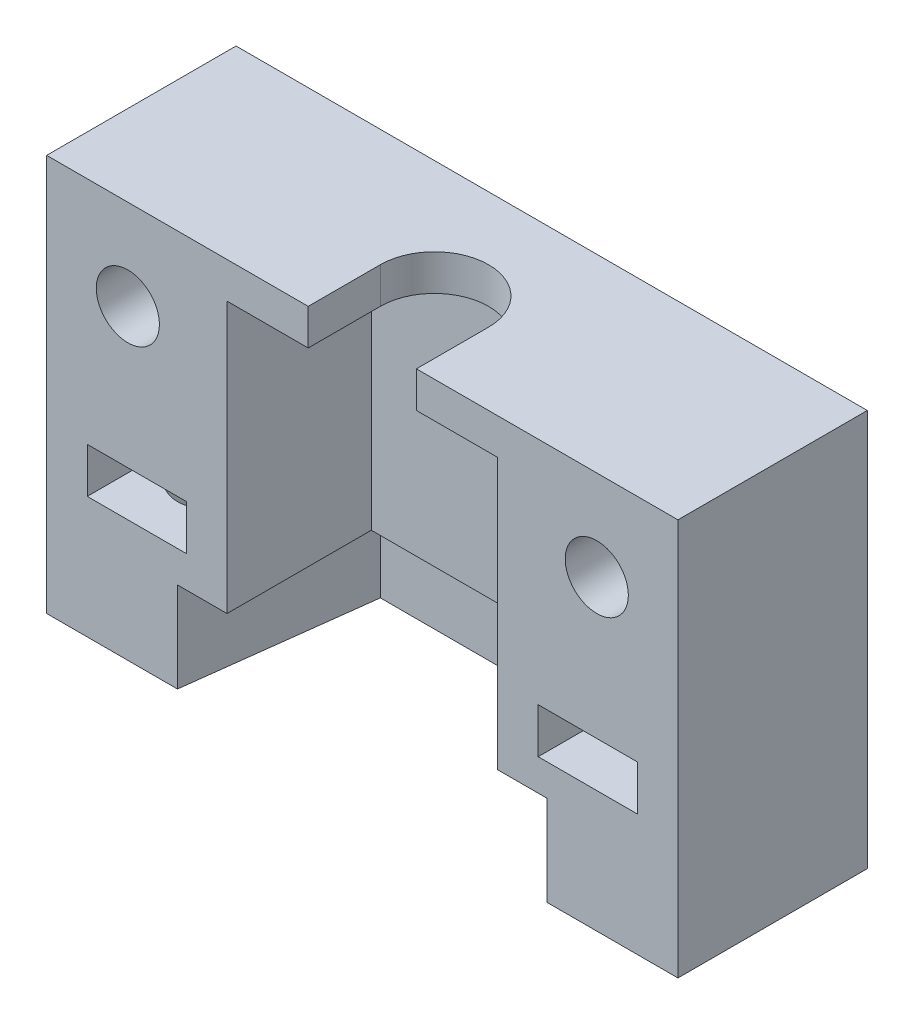
from build123d import *

# Parameters (mm, degrees)
ESQUISSE1_W             = 35
ESQUISSE1_H             = 13
ESQUISSE1_R             = 1.75
ESQUISSE1_R_2           = 1.5
BOSS_EXTRU_1_DEPTH      = 5
ESQUISSE2_W             = 35
ESQUISSE2_H             = 13
ESQUISSE2_R             = 1.5
ESQUISSE2_R_2           = 1.75
ESQUISSE2_W_2           = 15
ESQUISSE2_H_2           = 8
BOSS_EXTRU_2_DEPTH      = 15
ESQUISSE3_W             = 35
ESQUISSE3_H             = 13
ESQUISSE3_R             = 3
BOSS_EXTRU_3_DEPTH      = 2
ESQUISSE9_R             = 1.75
ENL_V_MAT_EXTRU_5_DEPTH = 31.971761332
ESQUISSE5_W             = 52.735375718
ESQUISSE5_H             = 32.07387294
ENL_V_MAT_EXTRU_1_DEPTH = 31.008332211
ENL_V_MAT_EXTRU_2_DEPTH = 28.358728137
ESQUISSE4_W             = 5.5
ESQUISSE4_H             = 2.5
ENL_V_MAT_EXTRU_3_DEPTH = 4
ENL_V_MAT_EXTRU_4_DEPTH = 2.5
ENL_V_MAT_EXTRU_6_DEPTH = 2.5


with BuildPart() as part:
    # Esquisse1 → Boss.-Extru.1 (new body)
    with BuildSketch(Plane(origin=(0, 0, 0), x_dir=(1, 0, 0), z_dir=(0, 1, 0))):
        Rectangle(ESQUISSE1_W, ESQUISSE1_H)
        with Locations(Location((-12.5, 0, 0), (0, 0, 270))):
            Circle(ESQUISSE1_R, mode=Mode.SUBTRACT)
        with Locations(Location((12.5, 0, 0), (0, 0, 270))):
            Circle(ESQUISSE1_R_2, mode=Mode.SUBTRACT)
        Polygon((-10.5, -6), (10.5, -6), (9, 6), (-9, 6), align=None, mode=Mode.SUBTRACT)
    extrude(amount=BOSS_EXTRU_1_DEPTH)

    # Esquisse2 → Boss.-Extru.2 (add)
    with BuildSketch(Plane(origin=(0, 5, 0), x_dir=(1, 0, 0), z_dir=(0, 1, 0))):
        Rectangle(ESQUISSE2_W, ESQUISSE2_H)
        with Locations(Location((12.5, 0, 0), (0, 0, 270))):
            Circle(ESQUISSE2_R, mode=Mode.SUBTRACT)
        with Locations(Location((-12.5, 0, 0), (0, 0, 270))):
            Circle(ESQUISSE2_R_2, mode=Mode.SUBTRACT)
        Rectangle(ESQUISSE2_W_2, ESQUISSE2_H_2, mode=Mode.SUBTRACT)
    extrude(amount=BOSS_EXTRU_2_DEPTH)

    # Esquisse3 → Boss.-Extru.3 (add)
    with BuildSketch(Plane(origin=(0, 20, 0), x_dir=(1, 0, 0), z_dir=(0, 1, 0))):
        Rectangle(ESQUISSE3_W, ESQUISSE3_H)
        with Locations(Location((0, 0, 0), (0, 0, 270))):
            Circle(ESQUISSE3_R, mode=Mode.SUBTRACT)
    extrude(amount=BOSS_EXTRU_3_DEPTH)

    # Esquisse9 → Enlèv. mat.-Extru.5 (cut, through all)
    with BuildSketch(Plane.XY.offset(6.5)):
        with Locations((-13, 17)):
            Circle(ESQUISSE9_R)
        with Locations((13, 17)):
            Circle(ESQUISSE9_R)
    extrude(amount=-ENL_V_MAT_EXTRU_5_DEPTH, mode=Mode.SUBTRACT)

    # Esquisse5 → Enlèv. mat.-Extru.1 (cut, through all)
    with BuildSketch(Plane(origin=(0, 0, 4), x_dir=(-1, 0, 0), z_dir=(0, 0, -1))):
        with Locations((3.176053458, 10.251854402)):
            Rectangle(ESQUISSE5_W, ESQUISSE5_H)
    extrude(amount=-ENL_V_MAT_EXTRU_1_DEPTH, mode=Mode.SUBTRACT)

    # Esquisse6 → Enlèv. mat.-Extru.2 (cut, through all)
    with BuildSketch(Plane.XZ.offset(-20)):
        with BuildLine():
            Line((-3, 4), (-3, 0))
            ThreePointArc((-3, 0), (0, 3), (3, 0))
            Line((3, 0), (3, 4))
            Line((3, 4), (-3, 4))
        make_face()
    extrude(amount=-ENL_V_MAT_EXTRU_2_DEPTH, mode=Mode.SUBTRACT)

    # Esquisse4 → Enlèv. mat.-Extru.3 (cut)
    with BuildSketch(Plane(origin=(0, 0, 4), x_dir=(-1, 0, 0), z_dir=(0, 0, -1))):
        with Locations((12.5, 8)):
            Rectangle(ESQUISSE4_W, ESQUISSE4_H)
    enl_v_mat_extru_3 = extrude(amount=ENL_V_MAT_EXTRU_3_DEPTH, mode=Mode.SUBTRACT)

    # Esquisse7 → Enlèv. mat.-Extru.4 (cut)
    with BuildSketch(Plane(origin=(0, 6.75, 0), x_dir=(1, 0, 0), z_dir=(0, 1, 0))):
        Polygon((-9.75, -1.58771324), (-9.75, 1.58771324), (-12.5, 3.175426481), (-15.25, 1.58771324), (-15.25, -1.58771324), (-12.5, -3.175426481), align=None)
    enl_v_mat_extru_4 = extrude(amount=ENL_V_MAT_EXTRU_4_DEPTH, mode=Mode.SUBTRACT)

    # Symétrie1: Enlèv. mat.-Extru.3, Enlèv. mat.-Extru.4 across plane
    add(enl_v_mat_extru_3.mirror(Plane.ZY), mode=Mode.SUBTRACT)
    add(enl_v_mat_extru_4.mirror(Plane.ZY), mode=Mode.SUBTRACT)

    # Esquisse10 → Enlèv. mat.-Extru.6 (cut)
    with BuildSketch(Plane(origin=(0, 0, -6.5), x_dir=(-1, 0, 0), z_dir=(0, 0, -1))):
        Polygon((-10.25, 15.41228676), (-10.25, 18.58771324), (-13, 20.175426481), (-15.75, 18.58771324), (-15.75, 15.41228676), (-13, 13.824573519), align=None)
        Polygon((13, 13.824573519), (15.75, 15.41228676), (15.75, 18.58771324), (13, 20.175426481), (10.25, 18.58771324), (10.25, 15.41228676), align=None)
    extrude(amount=-ENL_V_MAT_EXTRU_6_DEPTH, mode=Mode.SUBTRACT)


solid = part.part
